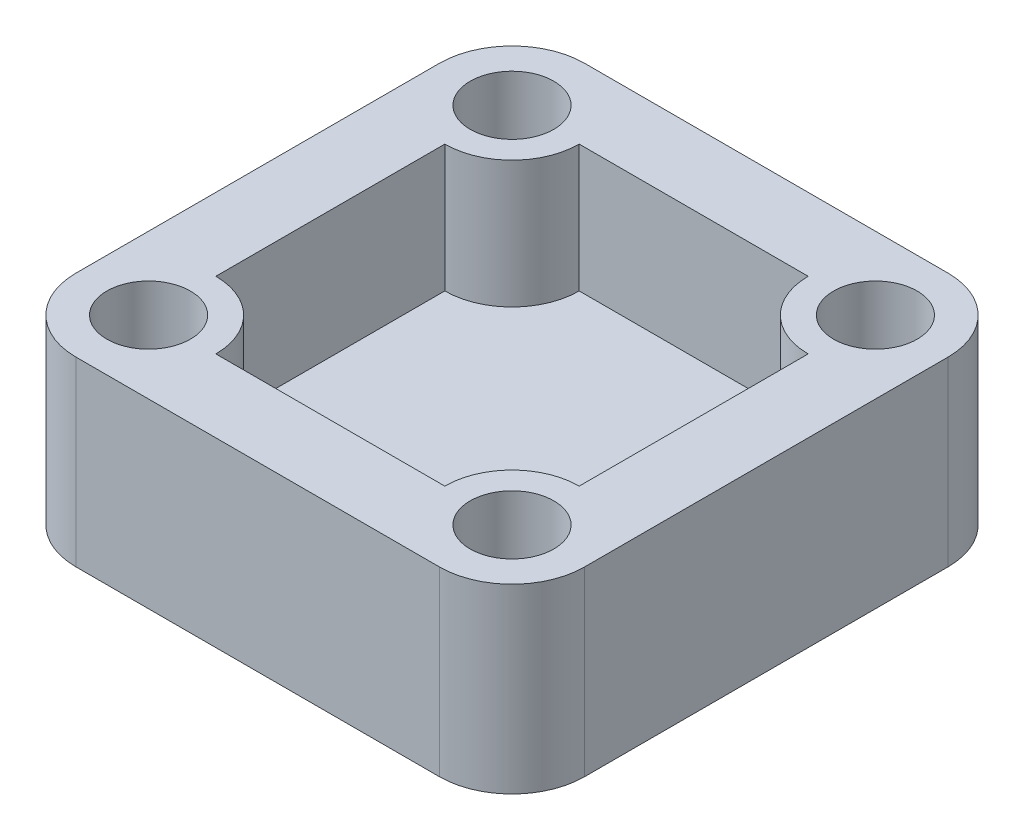
from build123d import *

# Parameters (mm, degrees)
BOSS_EXTRUDE1_DEPTH = 1.5
BOSS_EXTRUDE2_DEPTH = 3.5
SKETCH3_R           = 1.15
CUT_EXTRUDE1_DEPTH  = 12.090536506


with BuildPart() as part:
    # Sketch1 → Boss-Extrude1 (new body)
    with BuildSketch(Plane(origin=(0, 0, 0), x_dir=(1, 0, 0), z_dir=(0, 1, 0))):
        with BuildLine():
            Line((0, 7), (5, 7))
            ThreePointArc((5, 7), (6.414213562, 6.414213562), (7, 5))
            Line((7, 5), (7, 0))
            Line((7, 0), (7, -5))
            ThreePointArc((7, -5), (6.414213562, -6.414213562), (5, -7))
            Line((5, -7), (0, -7))
            Line((0, -7), (-5, -7))
            ThreePointArc((-5, -7), (-6.414213562, -6.414213562), (-7, -5))
            Line((-7, -5), (-7, 0))
            Line((-7, 0), (-7, 5))
            ThreePointArc((-7, 5), (-6.414213562, 6.414213562), (-5, 7))
            Line((-5, 7), (0, 7))
        make_face()
    extrude(amount=BOSS_EXTRUDE1_DEPTH)

    # Sketch2 → Boss-Extrude2 (add)
    with BuildSketch(Plane(origin=(0, 1.5, 0), x_dir=(1, 0, 0), z_dir=(0, 1, 0))):
        with BuildLine():
            Line((0, 7), (5, 7))
            ThreePointArc((5, 7), (6.414213562, 6.414213562), (7, 5))
            Line((7, 5), (7, 0))
            Line((7, 0), (7, -5))
            ThreePointArc((7, -5), (6.414213562, -6.414213562), (5, -7))
            Line((5, -7), (0, -7))
            Line((0, -7), (-5, -7))
            ThreePointArc((-5, -7), (-6.414213562, -6.414213562), (-7, -5))
            Line((-7, -5), (-7, 0))
            Line((-7, 0), (-7, 5))
            ThreePointArc((-7, 5), (-6.414213562, 6.414213562), (-5, 7))
            Line((-5, 7), (0, 7))
        make_face()
        with BuildLine():
            Line((0, 5), (3.15, 5))
            ThreePointArc((3.15, 5), (3.691852455, 3.691852455), (5, 3.15))
            Line((5, 3.15), (5, 0))
            Line((5, 0), (5, -3.15))
            ThreePointArc((5, -3.15), (3.691852455, -3.691852455), (3.15, -5))
            Line((3.15, -5), (0, -5))
            Line((0, -5), (-3.15, -5))
            ThreePointArc((-3.15, -5), (-3.691852455, -3.691852455), (-5, -3.15))
            Line((-5, -3.15), (-5, 0))
            Line((-5, 0), (-5, 3.15))
            ThreePointArc((-5, 3.15), (-3.691852455, 3.691852455), (-3.15, 5))
            Line((-3.15, 5), (0, 5))
        make_face(mode=Mode.SUBTRACT)
    extrude(amount=BOSS_EXTRUDE2_DEPTH)

    # Sketch3 → Cut-Extrude1 (cut, through all)
    with BuildSketch(Plane(origin=(0, 5, 0), x_dir=(1, 0, 0), z_dir=(0, 1, 0))):
        with Locations(Location((5, 5, 0), (0, 0, 270))):
            Circle(SKETCH3_R)
        with Locations(Location((5, -5, 0), (0, 0, 270))):
            Circle(SKETCH3_R)
        with Locations(Location((-5, -5, 0), (0, 0, 270))):
            Circle(SKETCH3_R)
        with Locations(Location((-5, 5, 0), (0, 0, 270))):
            Circle(SKETCH3_R)
    extrude(amount=-CUT_EXTRUDE1_DEPTH, mode=Mode.SUBTRACT)


solid = part.part
